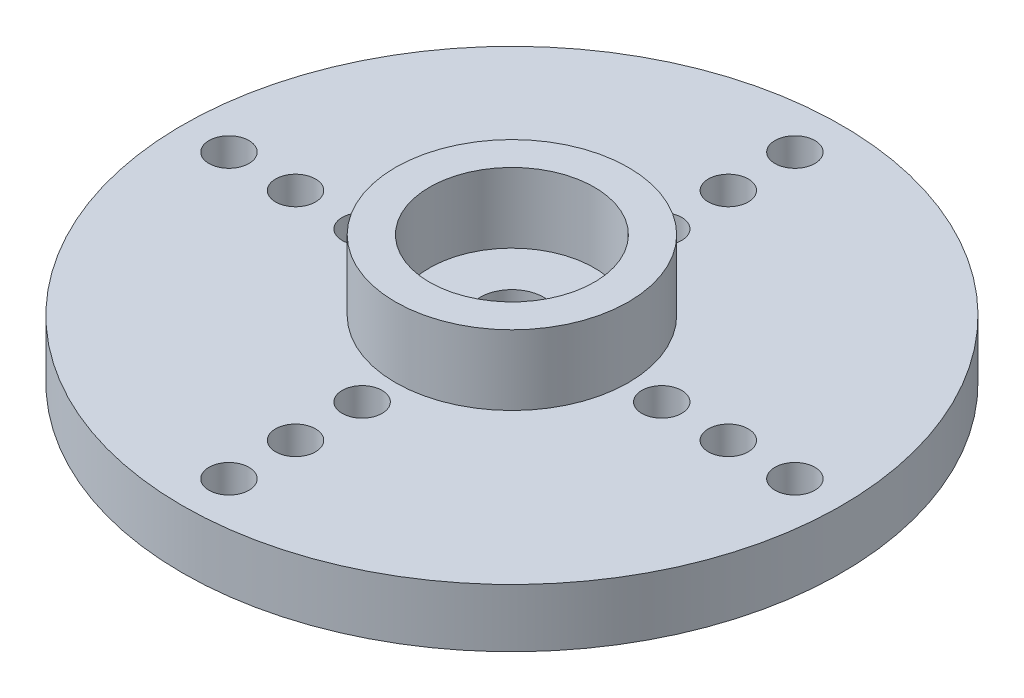
from build123d import *

# Parameters (mm, degrees)
ESQUISSE1_R                  = 9.9
BOSS_EXTRU_1_DEPTH           = 1.75
ESQUISSE2_R                  = 3.5
ESQUISSE2_R_2                = 2.475
BOSS_EXTRU_2_DEPTH           = 2.1
ESQUISSE3_R                  = 2.725
ESQUISSE3_R_2                = 2.225
BOSS_EXTRU_3_DEPTH           = 0.3
ESQUISSE4_R                  = 0.95
ENL_V_MAT_EXTRU_1_DEPTH      = 15.520416661
ESQUISSE5_R                  = 0.6
ENL_V_MAT_EXTRU_2_DEPTH      = 15.520416661
R_P_TITION_CIRCULAIRE1_COUNT = 4


with BuildPart() as part:
    # Esquisse1 → Boss.-Extru.1 (new body)
    with BuildSketch(Plane(origin=(0, 0, 0), x_dir=(1, 0, 0), z_dir=(0, 1, 0))):
        with Locations(Location((0, 0, 0), (0, 0, 270))):
            Circle(ESQUISSE1_R)
    extrude(amount=BOSS_EXTRU_1_DEPTH)

    # Esquisse2 → Boss.-Extru.2 (add)
    with BuildSketch(Plane(origin=(0, 1.75, 0), x_dir=(1, 0, 0), z_dir=(0, 1, 0))):
        with Locations(Location((0, 0, 0), (0, 0, 270))):
            Circle(ESQUISSE2_R)
        with Locations(Location((0, 0, 0), (0, 0, 270))):
            Circle(ESQUISSE2_R_2, mode=Mode.SUBTRACT)
    extrude(amount=BOSS_EXTRU_2_DEPTH)

    # Esquisse3 → Boss.-Extru.3 (add)
    with BuildSketch(Plane.XZ):
        with Locations(Location((0, 0, 0), (0, 0, 90))):
            Circle(ESQUISSE3_R)
        with Locations(Location((0, 0, 0), (0, 0, 270))):
            Circle(ESQUISSE3_R_2, mode=Mode.SUBTRACT)
    extrude(amount=BOSS_EXTRU_3_DEPTH)

    # Esquisse4 → Enlèv. mat.-Extru.1 (cut, through all)
    with BuildSketch(Plane.XZ):
        with Locations(Location((0, 0, 0), (0, 0, 270))):
            Circle(ESQUISSE4_R)
    extrude(amount=-ENL_V_MAT_EXTRU_1_DEPTH, mode=Mode.SUBTRACT)

    # Esquisse5 → Enlèv. mat.-Extru.2 (cut, through all)
    with BuildSketch(Plane.XZ):
        with Locations(Location((0, 4.5, 0), (0, 0, 270))):
            Circle(ESQUISSE5_R)
        with Locations(Location((0, 6.5, 0), (0, 0, 270))):
            Circle(ESQUISSE5_R)
        with Locations(Location((0, 8.5, 0), (0, 0, 270))):
            Circle(ESQUISSE5_R)
    enl_v_mat_extru_2 = extrude(amount=-ENL_V_MAT_EXTRU_2_DEPTH, mode=Mode.SUBTRACT)

    # Répétition circulaire1: Enlèv. mat.-Extru.2 ×4 about axis
    r_p_tition_circulaire1_axis = Axis((0, 0, 0), (0, 1, 0))
    for i in range(1, R_P_TITION_CIRCULAIRE1_COUNT):
        add(enl_v_mat_extru_2.rotate(r_p_tition_circulaire1_axis, i * 360 / R_P_TITION_CIRCULAIRE1_COUNT), mode=Mode.SUBTRACT)


solid = part.part
